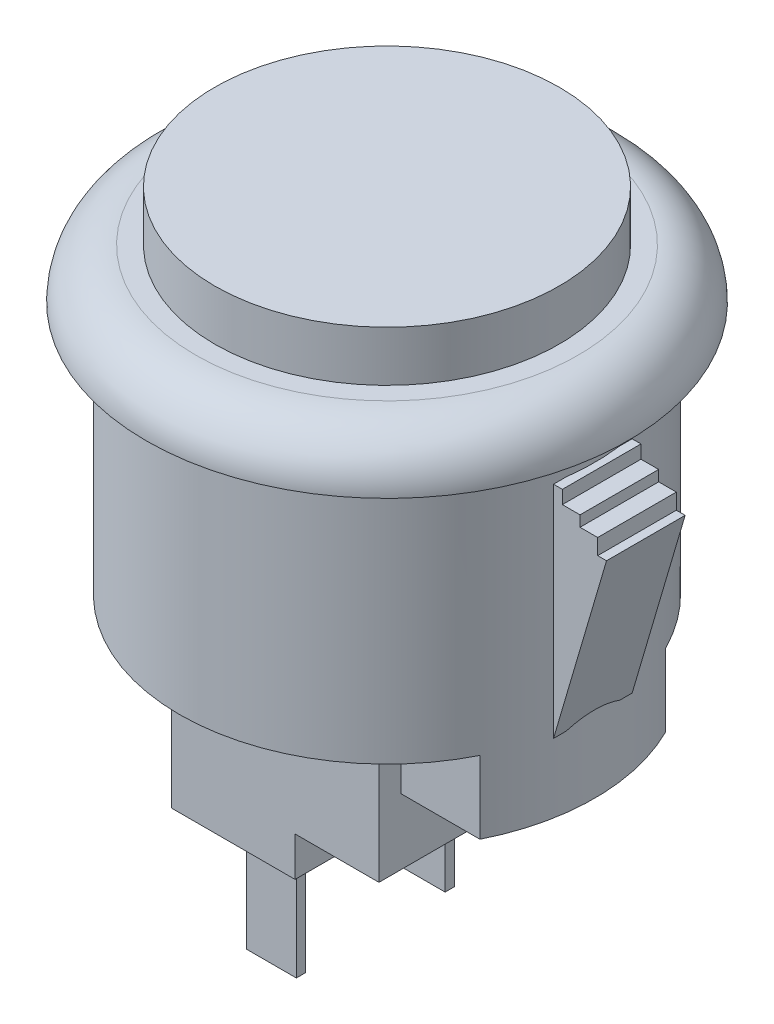
from build123d import *

# Parameters (mm, degrees)
BOSS_EXTRUDE1_DEPTH   = 6.33
BOSS_EXTRUDE2_DEPTH   = 4.11
SKETCH4_W             = 2.83
SKETCH4_H             = 0.53
BOSS_EXTRUDE3_DEPTH   = 6.65
BOSS_EXTRUDE4_DEPTH   = 2.225
BOSS_EXTRUDE4_2_DEPTH = 2.225


with BuildPart() as part:
    # Sketch1 → Revolve1 (revolve)
    with BuildSketch(Plane.XY, mode=Mode.PRIVATE) as revolve1_sk:
        with BuildLine():
            Line((0, 0), (-11.75, 0))
            Line((-11.75, 0), (-11.75, 14.35))
            Line((-11.75, 14.35), (-13.625, 14.35))
            ThreePointArc((-13.625, 14.35), (-12.804898987, 16.329898987), (-10.825, 17.15))
            Line((-10.825, 17.15), (-9.75, 17.15))
            Line((-9.75, 17.15), (-9.75, 20))
            Line((-9.75, 20), (0, 20))
            Line((0, 20), (0, 0))
        make_face()
    revolve(revolve1_sk.sketch.rotate(Axis((0, 0, 0), (0, -1, 0)), 270), axis=Axis((0, 0, 0), (0, -1, 0)))

    # Sketch2 → Boss-Extrude1 (add, symmetric)
    with BuildSketch(Plane.XY):
        Polygon((-5.875, 0), (-5.875, -10.23), (1.125, -10.23), (1.125, -8), (5.875, -8), (5.875, 0), align=None)
    extrude(amount=BOSS_EXTRUDE1_DEPTH, both=True)

    # Sketch3 → Boss-Extrude2 (add)
    with BuildSketch(Plane.XZ):
        with BuildLine():
            Line((-10.511898021, 5.25), (-6.036348234, 5.25))
            ThreePointArc((-6.036348234, 5.25), (-8, 0), (-6.036348234, -5.25))
            Line((-6.036348234, -5.25), (-10.511898021, -5.25))
            ThreePointArc((-10.511898021, -5.25), (-11.75, 0), (-10.511898021, 5.25))
        make_face()
        with BuildLine():
            Line((10.511898021, -5.25), (6.036348234, -5.25))
            ThreePointArc((6.036348234, -5.25), (8, 0), (6.036348234, 5.25))
            Line((6.036348234, 5.25), (10.511898021, 5.25))
            ThreePointArc((10.511898021, 5.25), (11.75, 0), (10.511898021, -5.25))
        make_face()
    extrude(amount=BOSS_EXTRUDE2_DEPTH)

    # Sketch4 → Boss-Extrude3 (add)
    with BuildSketch(Plane.XZ.offset(10.23)):
        with Locations((-2.07, 4.21)):
            Rectangle(SKETCH4_W, SKETCH4_H)
        with Locations((-2.07, -4.21)):
            Rectangle(SKETCH4_W, SKETCH4_H)
    extrude(amount=BOSS_EXTRUDE3_DEPTH)


with BuildPart() as body_2:
    # Sketch5 → Boss-Extrude4 (new, symmetric)
    with BuildSketch(Plane.XY):
        Polygon((-11.65, -0.11), (-14.65, 10.1), (-14.15, 10.1), (-14.15, 10.99), (-13.15, 10.99), (-13.15, 11.6), (-12.15, 11.6), (-12.15, 12.35), (-11.65, 12.35), align=None)
    extrude(amount=BOSS_EXTRUDE4_DEPTH, both=True)


with BuildPart() as body_3:
    # Sketch5 → Boss-Extrude4 2 (new, symmetric)
    with BuildSketch(Plane.XY):
        Polygon((11.65, 12.35), (11.65, -0.11), (14.65, 10.1), (14.15, 10.1), (14.15, 10.99), (13.15, 10.99), (13.15, 11.6), (12.15, 11.6), (12.15, 12.35), align=None)
    extrude(amount=BOSS_EXTRUDE4_2_DEPTH, both=True)

    # Combine2: union body 2, part
    add(body_2.part)
    add(part.part)


solid = body_3.part
